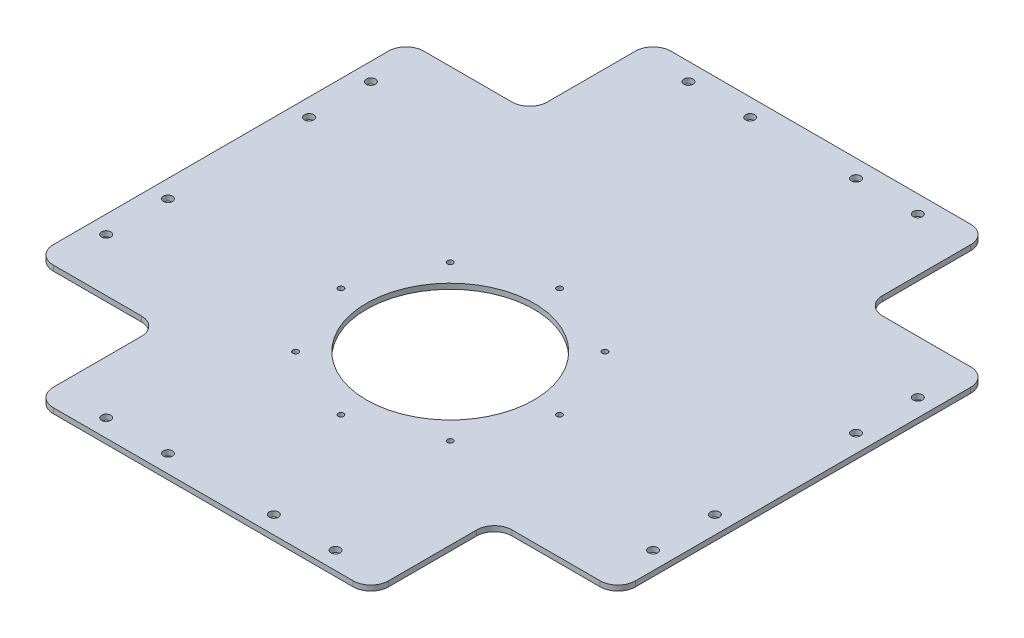
from build123d import *

# Parameters (mm, degrees)
SKETCH1_R           = 56
BOSS_EXTRUDE1_DEPTH = 3
FILLET1_R           = 10
SKETCH2_R           = 2.6
SKETCH2_R_2         = 1.6
CUT_EXTRUDE1_DEPTH  = 482.049893462
BOSS_EXTRUDE2_START = -3
SKETCH3_R           = 56
SKETCH3_R_2         = 47.5
BOSS_EXTRUDE2_DEPTH = 3


with BuildPart() as part:
    # Sketch1 → Boss-Extrude1 (new body)
    with BuildSketch(Plane(origin=(0, 0, 0), x_dir=(1, 0, 0), z_dir=(0, 1, 0))):
        Polygon((70, 70), (70, 0), (260, 0), (260, 70), (330, 70), (330, 280), (260, 280), (260, 350), (70, 350), (70, 280), (0, 280), (0, 70), align=None)
        with Locations(Location((165, 140, 0), (0, 0, 270))):
            Circle(SKETCH1_R, mode=Mode.SUBTRACT)
    extrude(amount=BOSS_EXTRUDE1_DEPTH)

    # Fillet1
    fillet1_edges = [part.edges().sort_by_distance(p)[0] for p in [
        (70, 1.5, 0),
        (70, 1.5, -70),
        (0, 1.5, -70),
        (0, 1.5, -280),
        (70, 1.5, -280),
        (70, 1.5, -350),
        (260, 1.5, -350),
        (260, 1.5, -280),
        (330, 1.5, -280),
        (330, 1.5, -70),
        (260, 1.5, -70),
        (260, 1.5, 0),
    ]]
    fillet(fillet1_edges, radius=FILLET1_R)

    # Sketch2 → Cut-Extrude1 (cut, through all)
    with BuildSketch(Plane(origin=(0, 3, 0), x_dir=(1, 0, 0), z_dir=(0, 1, 0))):
        with Locations(Location((100, 340, 0), (0, 0, 270))):
            Circle(SKETCH2_R)
        with Locations(Location((135, 340, 0), (0, 0, 270))):
            Circle(SKETCH2_R)
        with Locations(Location((195, 340, 0), (0, 0, 270))):
            Circle(SKETCH2_R)
        with Locations(Location((230, 340, 0), (0, 0, 270))):
            Circle(SKETCH2_R)
        with Locations(Location((10, 250, 0), (0, 0, 270))):
            Circle(SKETCH2_R)
        with Locations(Location((10, 215, 0), (0, 0, 270))):
            Circle(SKETCH2_R)
        with Locations(Location((10, 100, 0), (0, 0, 270))):
            Circle(SKETCH2_R)
        with Locations(Location((10, 135, 0), (0, 0, 270))):
            Circle(SKETCH2_R)
        with Locations(Location((100, 10, 0), (0, 0, 270))):
            Circle(SKETCH2_R)
        with Locations(Location((135, 10, 0), (0, 0, 270))):
            Circle(SKETCH2_R)
        with Locations(Location((195, 10, 0), (0, 0, 270))):
            Circle(SKETCH2_R)
        with Locations(Location((230, 10, 0), (0, 0, 270))):
            Circle(SKETCH2_R)
        with Locations(Location((320, 100, 0), (0, 0, 270))):
            Circle(SKETCH2_R)
        with Locations(Location((320, 135, 0), (0, 0, 270))):
            Circle(SKETCH2_R)
        with Locations(Location((320, 250, 0), (0, 0, 270))):
            Circle(SKETCH2_R)
        with Locations(Location((320, 215, 0), (0, 0, 270))):
            Circle(SKETCH2_R)
        with Locations(Location((165, 202, 0), (0, 0, 270))):
            Circle(SKETCH2_R_2)
        with Locations(Location((208.840620434, 183.840620434, 0), (0, 0, 270))):
            Circle(SKETCH2_R_2)
        with Locations(Location((227, 140, 0), (0, 0, 270))):
            Circle(SKETCH2_R_2)
        with Locations(Location((208.840620434, 96.159379566, 0), (0, 0, 270))):
            Circle(SKETCH2_R_2)
        with Locations(Location((165, 78, 0), (0, 0, 270))):
            Circle(SKETCH2_R_2)
        with Locations(Location((121.159379566, 96.159379566, 0), (0, 0, 270))):
            Circle(SKETCH2_R_2)
        with Locations(Location((103, 140, 0), (0, 0, 270))):
            Circle(SKETCH2_R_2)
        with Locations(Location((121.159379566, 183.840620434, 0), (0, 0, 270))):
            Circle(SKETCH2_R_2)
    extrude(amount=-CUT_EXTRUDE1_DEPTH, mode=Mode.SUBTRACT)

    # Sketch3 → Boss-Extrude2 (add)
    with BuildSketch(Plane(origin=(0, 3, 0), x_dir=(1, 0, 0), z_dir=(0, 1, 0)).offset(BOSS_EXTRUDE2_START)):
        with Locations((165, 140)):
            Circle(SKETCH3_R)
        with Locations(Location((165, 140, 0), (0, 0, 270))):
            Circle(SKETCH3_R_2, mode=Mode.SUBTRACT)
    extrude(amount=BOSS_EXTRUDE2_DEPTH)


solid = part.part
